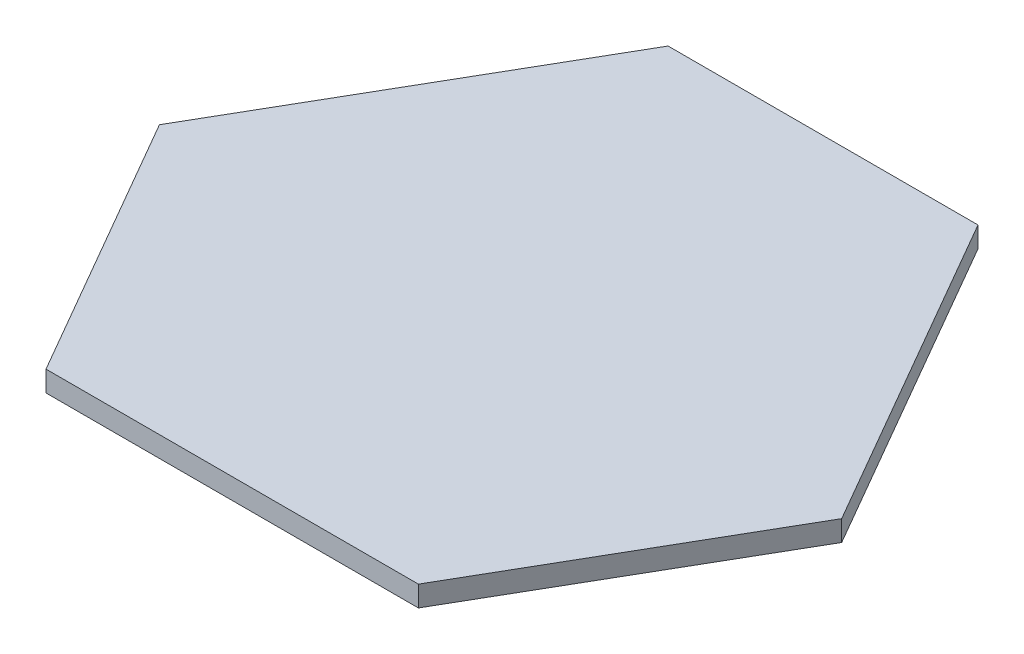
from build123d import *

# Parameters (mm, degrees)
EXTRUDE_1_DEPTH = 10


with BuildPart() as part:
    # 草圖1 → 填料-伸長1 (new body)
    with BuildSketch(Plane(origin=(0, 0, 0), x_dir=(1, 0, 0), z_dir=(0, 1, 0))):
        Polygon((-90.122176988, 0), (90.122176988, 0), (165.122176988, 129.903810568), (75, 286), (-75, 286), (-165.122176988, 129.903810568), align=None)
    extrude(amount=EXTRUDE_1_DEPTH)


solid = part.part
